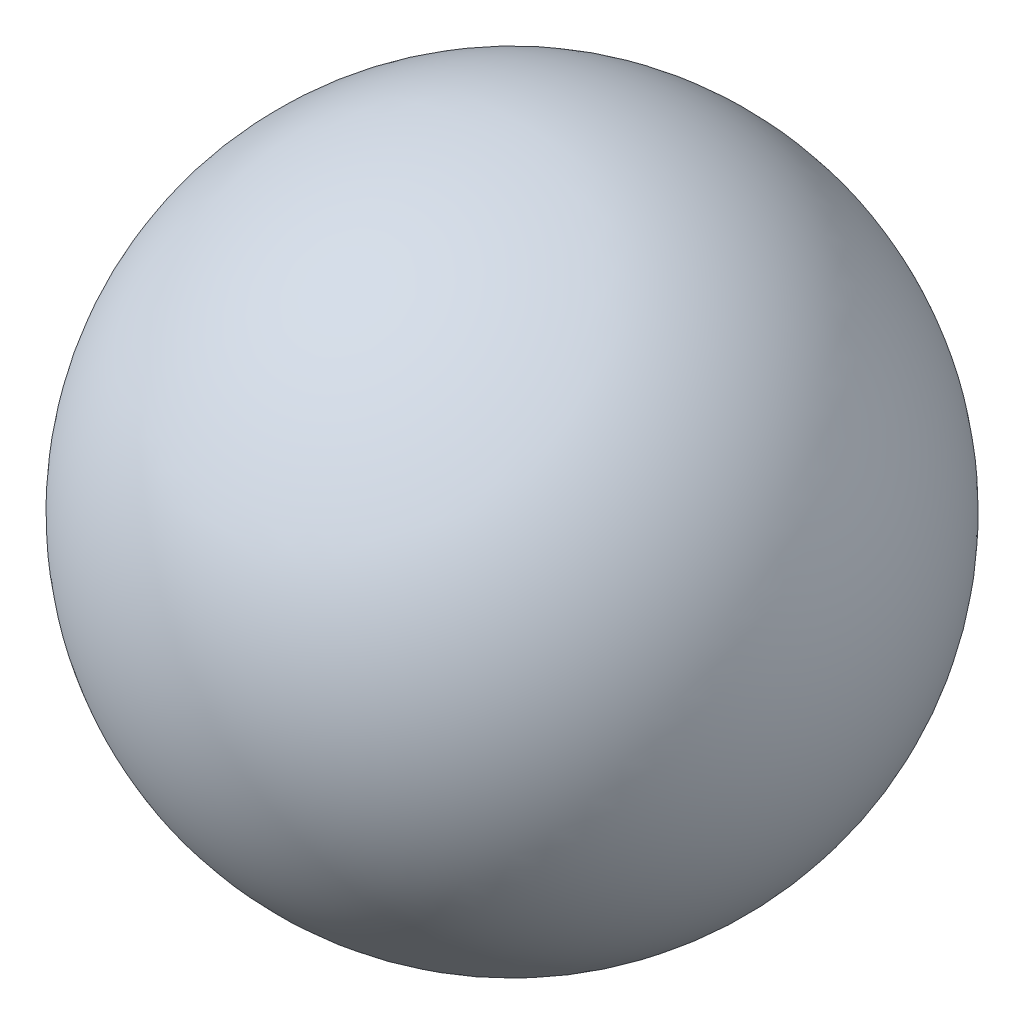
from build123d import *


with BuildPart() as part:
    # Sketch1 → Revolve9 (revolve)
    with BuildSketch(Plane(origin=(0, 0, 0), x_dir=(1, 0, 0), z_dir=(0, 1, 0))):
        with BuildLine():
            Line((0, -15), (0, 15))
            ThreePointArc((0, 15), (15, 0), (0, -15))
        make_face()
    revolve(axis=Axis((0, 0, 15), (0, 0, -1)))


solid = part.part
